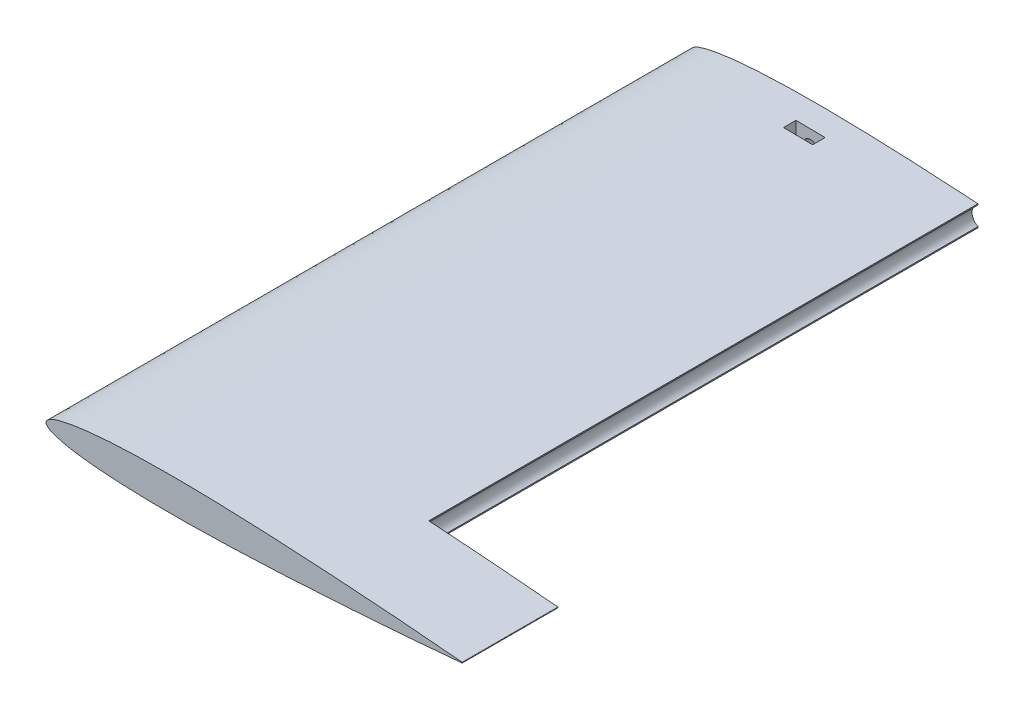
from build123d import *

# Parameters (mm, degrees)
CORPOFOAM_DEPTH             = 132
FOAMLATERALE_DEPTH          = 23
SCHIZZO2_R                  = 3
FOROLONGHERONE_DEPTH        = 185.547595795
SCHIZZO6_W                  = 3
SCHIZZO6_H                  = 5.01489576
SMUSSOPOSTERIORE_DEPTH      = 132
SCHIZZO8_R                  = 1.5
FOROPERNO_DEPTH             = 185.547595795
SCHIZZO9_R                  = 3
SCHIZZO9_R_2                = 1.5
CHIUSURAFORITERMINALI_DEPTH = 5
SCHIZZO10_R                 = 1.75
FOROVITE_DEPTH              = 13
TAGLIODADO_DEPTH            = 3


with BuildPart() as part:
    # Schizzo1 → CorpoFoam (new body)
    with BuildSketch(Plane.XY):
        with BuildLine():
            ThreePointArc((70, -2.443), (67.557, 0), (70, 2.443))
            add(Edge.make_bspline(
                [(70, 2.443), (66.667669045, 2.659279734), (60.003104625, 3.061747723), (50.003008601, 3.552139212), (40.002598558, 3.902946494), (31.666961486, 4.025260151), (24.9991546, 3.976933791), (19.997775587, 3.844976398), (14.993363131, 3.592486959), (10.827184065, 3.237651579), (7.489054388, 2.814021367), (4.99359465, 2.403673059), (2.84962634, 1.867925494), (1.165413503, 1.320987252), (-0.664613784, 0), (1.165413503, -1.320987252), (2.84962634, -1.867925494), (4.99359465, -2.403673059), (7.489054388, -2.814021367), (10.827184065, -3.237651579), (14.993363131, -3.592486959), (19.997775587, -3.844976398), (24.9991546, -3.976933791), (31.666961486, -4.025260151), (40.002598558, -3.902946494), (50.003008601, -3.552139212), (60.003104625, -3.061747723), (66.667669045, -2.659279734), (70, -2.443)],
                knots=[0.149112224, 0.149112224, 0.149112224, 0.149112224, 0.198750974, 0.248359097, 0.29793737, 0.347491327, 0.37226694, 0.397050924, 0.421859475, 0.446731346, 0.459220451, 0.471790602, 0.484560454, 0.491195112, 0.5, 0.508804888, 0.515439546, 0.528209398, 0.540779549, 0.553268654, 0.578140525, 0.602949076, 0.62773306, 0.652508673, 0.70206263, 0.751640903, 0.801249026, 0.850887776, 0.850887776, 0.850887776, 0.850887776], degree=3))
        make_face()
    extrude(amount=CORPOFOAM_DEPTH)

    # Schizzo7 → FoamLaterale (add)
    with BuildSketch(Plane.XY.offset(132)):
        with BuildLine():
            ThreePointArc((100, 0.084), (100.084, 0), (100, -0.084))
            add(Edge.make_bspline(
                [(100, 0.084), (98.333488815, 0.23674648), (95.001194725, 0.542172689), (88.335559621, 1.11089898), (80.003293356, 1.763610995), (70.002998933, 2.457861693), (60.003104625, 3.061747723), (50.003008601, 3.552139212), (40.002598558, 3.902946494), (31.666961486, 4.025260151), (24.9991546, 3.976933791), (19.997775587, 3.844976398), (14.993363131, 3.592486959), (10.827184065, 3.237651579), (7.489054388, 2.814021367), (4.99359465, 2.403673059), (2.84962634, 1.867925494), (1.165413503, 1.320987252), (-0.664613784, 0), (1.165413503, -1.320987252), (2.84962634, -1.867925494), (4.99359465, -2.403673059), (7.489054388, -2.814021367), (10.827184065, -3.237651579), (14.993363131, -3.592486959), (19.997775587, -3.844976398), (24.9991546, -3.976933791), (31.666961486, -4.025260151), (40.002598558, -3.902946494), (50.003008601, -3.552139212), (60.003104625, -3.061747723), (70.002998933, -2.457861693), (80.003293356, -1.763610995), (88.335559621, -1.11089898), (95.001194725, -0.542172689), (98.333488815, -0.23674648), (100, -0.084)],
                knots=[0, 0, 0, 0, 0.024876293, 0.049741715, 0.099443402, 0.149112224, 0.198750974, 0.248359097, 0.29793737, 0.347491327, 0.37226694, 0.397050924, 0.421859475, 0.446731346, 0.459220451, 0.471790602, 0.484560454, 0.491195112, 0.5, 0.508804888, 0.515439546, 0.528209398, 0.540779549, 0.553268654, 0.578140525, 0.602949076, 0.62773306, 0.652508673, 0.70206263, 0.751640903, 0.801249026, 0.850887776, 0.900556598, 0.950258285, 0.975123707, 1, 1, 1, 1], degree=3))
        make_face()
    extrude(amount=FOAMLATERALE_DEPTH)

    # Schizzo2 → ForoLongherone (cut, through all)
    with BuildSketch(Plane.XY.offset(155)):
        with Locations((25, 0)):
            Circle(SCHIZZO2_R)
    extrude(amount=-FOROLONGHERONE_DEPTH, mode=Mode.SUBTRACT)

    # Schizzo6 → SmussoPosteriore (cut)
    with BuildSketch(Plane(origin=(0, 0, 0), x_dir=(-1, 0, 0), z_dir=(0, 0, -1))):
        with Locations((-70.5, 0)):
            Rectangle(SCHIZZO6_W, SCHIZZO6_H)
    extrude(amount=-SMUSSOPOSTERIORE_DEPTH, mode=Mode.SUBTRACT)

    # Schizzo8 → ForoPerno (cut, through all)
    with BuildSketch(Plane.XY.offset(155)):
        with Locations((71, 0)):
            Circle(SCHIZZO8_R)
    extrude(amount=-FOROPERNO_DEPTH, mode=Mode.SUBTRACT)

    # Schizzo9 → ChiusuraForiTerminali (add)
    with BuildSketch(Plane.XY.offset(155)):
        with Locations((25, 0)):
            Circle(SCHIZZO9_R)
        with Locations((71, 0)):
            Circle(SCHIZZO9_R_2)
    extrude(amount=-CHIUSURAFORITERMINALI_DEPTH)

    # Schizzo10 → ForoVite (cut)
    with BuildSketch(Plane(origin=(0, 0, 0), x_dir=(-1, 0, 0), z_dir=(0, 0, -1))):
        with Locations((-34.75, 0)):
            Circle(SCHIZZO10_R)
    extrude(amount=-FOROVITE_DEPTH, mode=Mode.SUBTRACT)

    # Schizzo11 → TaglioDado (cut)
    with BuildSketch(Plane.XY.offset(6)):
        Polygon((31.25, 0), (31.25, 7.705150835), (38.25, 7.705150835), (38.25, 0), (36.5, -3.031088913), (33, -3.031088913), align=None)
    extrude(amount=TAGLIODADO_DEPTH, mode=Mode.SUBTRACT)


solid = part.part
